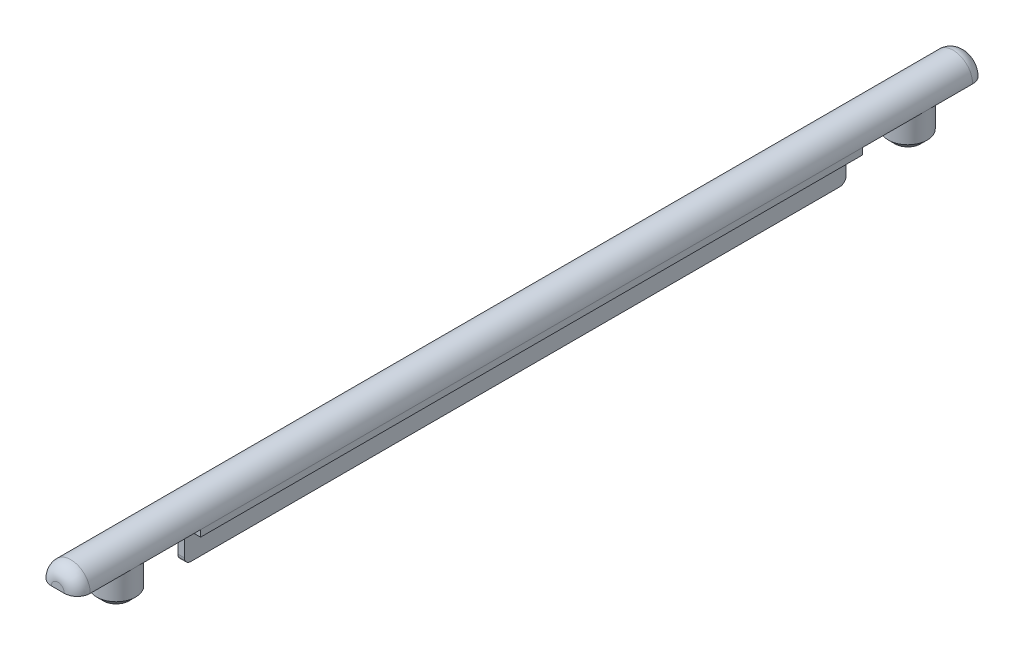
from build123d import *

# Parameters (mm, degrees)
EXTRUDE_2_DEPTH     = 140
SKETCH_4_W          = 6
SKETCH_4_H          = 19
CUT_EXTRUDE_1_DEPTH = 1
SKETCH_3_R          = 3
EXTRUDE_4_DEPTH     = 5
CHAMFER_2_SIZE      = 1
FILLET_2_R          = 2
SKETCH_5_W          = 1
SKETCH_5_H          = 102
EXTRUDE_5_DEPTH     = 5
FILLET_3_R          = 1


with BuildPart() as part:
    # 草图2 → 凸台-拉伸2 (new body)
    with BuildSketch(Plane.XY):
        with BuildLine():
            Line((-3, 0), (3, 0))
            Line((3, 0), (3, 1))
            ThreePointArc((3, 1), (0, 4), (-3, 1))
            Line((-3, 1), (-3, 0))
        make_face()
    extrude(amount=EXTRUDE_2_DEPTH)

    # 草图4 → 切除-拉伸1 (cut)
    with BuildSketch(Plane.XZ):
        with Locations((0, 130.5)):
            Rectangle(SKETCH_4_W, SKETCH_4_H)
        with Locations((0, 9.5)):
            Rectangle(SKETCH_4_W, SKETCH_4_H)
    extrude(amount=-CUT_EXTRUDE_1_DEPTH, mode=Mode.SUBTRACT)

    # 草图3 → 凸台-拉伸4 (add)
    with BuildSketch(Plane.XZ.offset(-1)):
        with Locations(Location((0, 131, 0), (0, 0, 180))):
            Circle(SKETCH_3_R)
        with Locations(Location((0, 9, 0), (0, 0, 180))):
            Circle(SKETCH_3_R)
    extrude(amount=EXTRUDE_4_DEPTH)

    # 倒角2
    chamfer_2_edges = [part.edges().sort_by_distance(p)[0] for p in [
        (3, -4, 131),
        (3, -4, 9),
    ]]
    chamfer(chamfer_2_edges, length=CHAMFER_2_SIZE)

    # 圆角2
    fillet_2_edges = [part.edges().sort_by_distance(p)[0] for p in [
        (0, 4, 140),
        (0, 4, 0),
    ]]
    fillet(fillet_2_edges, radius=FILLET_2_R)

    # 草图5 → 凸台-拉伸5 (add)
    with BuildSketch(Plane.XZ):
        with Locations((0, 70)):
            Rectangle(SKETCH_5_W, SKETCH_5_H)
    extrude(amount=EXTRUDE_5_DEPTH)

    # 圆角3
    fillet_3_edges = [part.edges().sort_by_distance(p)[0] for p in [
        (0, -5, 19),
        (0, -5, 121),
    ]]
    fillet(fillet_3_edges, radius=FILLET_3_R)


solid = part.part
